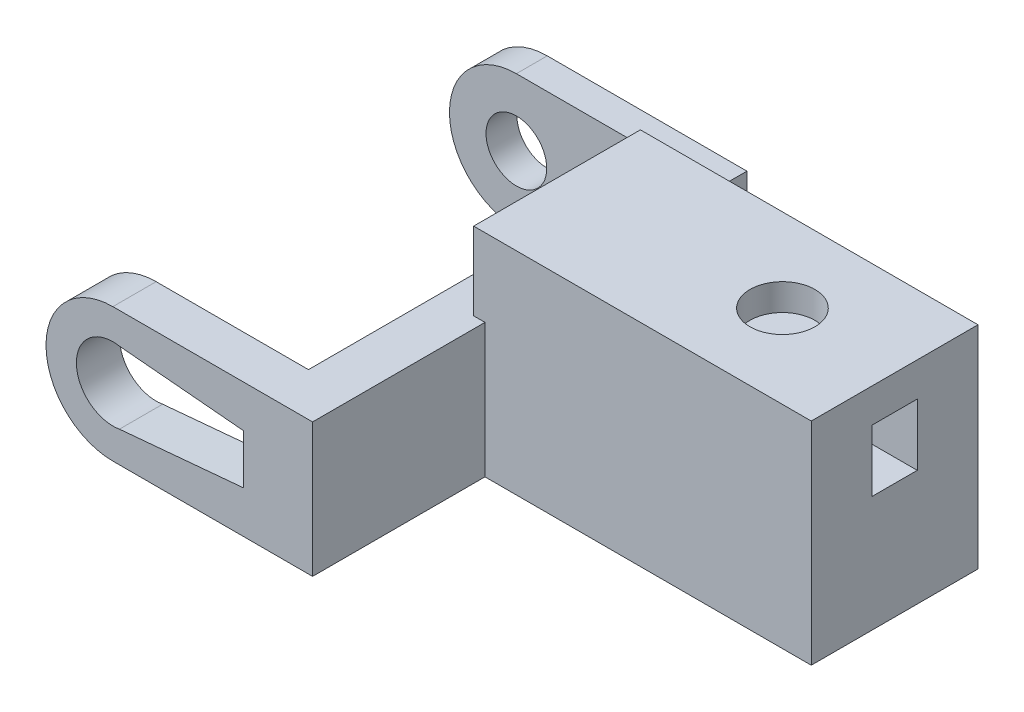
from build123d import *

# Parameters (mm, degrees)
BOSS_EXTRUDE1_START = -60.725
SKETCH1_W           = 32.8
SKETCH1_H           = 16.2
BOSS_EXTRUDE1_DEPTH = 10.275
BOSS_EXTRUDE2_START = -42.3
SKETCH2_W           = 42.2
SKETCH2_H           = 13
BOSS_EXTRUDE2_DEPTH = 2.3
BOSS_EXTRUDE3_START = 22.75
SKETCH3_R           = 6.5
BOSS_EXTRUDE3_DEPTH = 2.1
BOSS_EXTRUDE4_START = 22.75
SKETCH4_W           = 18.3
SKETCH4_H           = 13
BOSS_EXTRUDE4_DEPTH = 2.1
CUT_EXTRUDE1_START  = 22.75
SKETCH5_R           = 3.55
CUT_EXTRUDE1_DEPTH  = 2.1
CUT_EXTRUDE2_START  = 22.75
CUT_EXTRUDE2_DEPTH  = 2.1
BOSS_EXTRUDE5_START = -15.85
SKETCH7_R           = 6.5
BOSS_EXTRUDE5_DEPTH = 1.5
BOSS_EXTRUDE6_START = -15.85
SKETCH8_W           = 18.3
SKETCH8_H           = 13
BOSS_EXTRUDE6_DEPTH = 1.5
CUT_EXTRUDE3_START  = -15.85
SKETCH9_R           = 2.95
CUT_EXTRUDE3_DEPTH  = 1.5
CUT_EXTRUDE4_START  = -62.375
SKETCH10_W          = 23.2
SKETCH10_H          = 13
CUT_EXTRUDE4_DEPTH  = 8.625
CUT_EXTRUDE5_START  = -68
SKETCH11_R          = 1
CUT_EXTRUDE5_DEPTH  = 3
CUT_EXTRUDE6_START  = -68
SKETCH12_R          = 1
CUT_EXTRUDE6_DEPTH  = 3
CUT_EXTRUDE7_START  = -51.75
SKETCH13_R          = 3.15
CUT_EXTRUDE7_DEPTH  = 1.3
CUT_EXTRUDE8_START  = -10.7
SKETCH14_W          = 4.4
SKETCH14_H          = 6
CUT_EXTRUDE8_DEPTH  = 2.4


with BuildPart() as part:
    # Sketch1 → Boss-Extrude1 (new, symmetric)
    with BuildSketch(Plane(origin=(0, 0, 0), x_dir=(1, 0, 0), z_dir=(0, 1, 0)).offset(BOSS_EXTRUDE1_START)):
        with Locations((-24.7, 0)):
            Rectangle(SKETCH1_W, SKETCH1_H)
    extrude(amount=BOSS_EXTRUDE1_DEPTH, both=True)

    # Sketch2 → Boss-Extrude2 (add, symmetric)
    with BuildSketch(Plane(origin=(0, 0, 0), x_dir=(0, 0, -1), z_dir=(1, 0, 0)).offset(BOSS_EXTRUDE2_START)):
        with Locations((-3.75, -64.5)):
            Rectangle(SKETCH2_W, SKETCH2_H)
    extrude(amount=BOSS_EXTRUDE2_DEPTH, both=True)



with BuildPart() as body_2:
    # Sketch3 → Boss-Extrude3 (new, symmetric)
    with BuildSketch(Plane.XY.offset(BOSS_EXTRUDE3_START)):
        with Locations((-59.4, -64.5)):
            Circle(SKETCH3_R)
    extrude(amount=BOSS_EXTRUDE3_DEPTH, both=True)


with BuildPart() as part_1:
    add(part.part)

    add(body_2.part)  # Boss-Extrude4 merges body 2
    # Sketch4 → Boss-Extrude4 (add, symmetric)
    with BuildSketch(Plane.XY.offset(BOSS_EXTRUDE4_START)):
        with Locations((-50.25, -64.5)):
            Rectangle(SKETCH4_W, SKETCH4_H)
    extrude(amount=BOSS_EXTRUDE4_DEPTH, both=True)

    # Sketch5 → Cut-Extrude1 (cut, symmetric)
    with BuildSketch(Plane.XY.offset(CUT_EXTRUDE1_START)):
        with Locations((-59.4, -64.5)):
            Circle(SKETCH5_R)
    extrude(amount=CUT_EXTRUDE1_DEPTH, both=True, mode=Mode.SUBTRACT)

    # Sketch6 → Cut-Extrude2 (cut, symmetric)
    with BuildSketch(Plane.XY.offset(CUT_EXTRUDE2_START)):
        Polygon((-59.4, -60.95), (-46.7, -62.096718595), (-46.7, -66.903281405), (-59.4, -68.05), align=None)
    extrude(amount=CUT_EXTRUDE2_DEPTH, both=True, mode=Mode.SUBTRACT)



with BuildPart() as body_2_2:
    # Sketch7 → Boss-Extrude5 (new, symmetric)
    with BuildSketch(Plane.XY.offset(BOSS_EXTRUDE5_START)):
        with Locations((-59.4, -64.5)):
            Circle(SKETCH7_R)
    extrude(amount=BOSS_EXTRUDE5_DEPTH, both=True)


with BuildPart() as part_2:
    add(part_1.part)

    add(body_2_2.part)  # Boss-Extrude6 merges body 2 2
    # Sketch8 → Boss-Extrude6 (add, symmetric)
    with BuildSketch(Plane.XY.offset(BOSS_EXTRUDE6_START)):
        with Locations((-50.25, -64.5)):
            Rectangle(SKETCH8_W, SKETCH8_H)
    extrude(amount=BOSS_EXTRUDE6_DEPTH, both=True)

    # Sketch9 → Cut-Extrude3 (cut, symmetric)
    with BuildSketch(Plane.XY.offset(CUT_EXTRUDE3_START)):
        with Locations((-59.4, -64.5)):
            Circle(SKETCH9_R)
    extrude(amount=CUT_EXTRUDE3_DEPTH, both=True, mode=Mode.SUBTRACT)

    # Sketch10 → Cut-Extrude4 (cut, symmetric)
    with BuildSketch(Plane(origin=(0, 0, 0), x_dir=(1, 0, 0), z_dir=(0, 1, 0)).offset(CUT_EXTRUDE4_START)):
        with Locations((-24.7, 0)):
            Rectangle(SKETCH10_W, SKETCH10_H)
    extrude(amount=CUT_EXTRUDE4_DEPTH, both=True, mode=Mode.SUBTRACT)

    # Sketch11 → Cut-Extrude5 (cut, symmetric)
    with BuildSketch(Plane(origin=(0, 0, 0), x_dir=(1, 0, 0), z_dir=(0, 1, 0)).offset(CUT_EXTRUDE5_START)):
        with Locations(Location((-38.45, 0, 0), (0, 0, 270))):
            Circle(SKETCH11_R)
    extrude(amount=CUT_EXTRUDE5_DEPTH, both=True, mode=Mode.SUBTRACT)

    # Sketch12 → Cut-Extrude6 (cut, symmetric)
    with BuildSketch(Plane(origin=(0, 0, 0), x_dir=(1, 0, 0), z_dir=(0, 1, 0)).offset(CUT_EXTRUDE6_START)):
        with Locations(Location((-10.95, 0, 0), (0, 0, 270))):
            Circle(SKETCH12_R)
    extrude(amount=CUT_EXTRUDE6_DEPTH, both=True, mode=Mode.SUBTRACT)

    # Sketch13 → Cut-Extrude7 (cut, symmetric)
    with BuildSketch(Plane(origin=(0, 0, 0), x_dir=(1, 0, 0), z_dir=(0, 1, 0)).offset(CUT_EXTRUDE7_START)):
        with Locations(Location((-19.2, 0, 0), (0, 0, 270))):
            Circle(SKETCH13_R)
    extrude(amount=CUT_EXTRUDE7_DEPTH, both=True, mode=Mode.SUBTRACT)

    # Sketch14 → Cut-Extrude8 (cut, symmetric)
    with BuildSketch(Plane(origin=(0, 0, 0), x_dir=(0, 0, -1), z_dir=(1, 0, 0)).offset(CUT_EXTRUDE8_START)):
        with Locations((0, -56.75)):
            Rectangle(SKETCH14_W, SKETCH14_H)
    extrude(amount=CUT_EXTRUDE8_DEPTH, both=True, mode=Mode.SUBTRACT)


solid = part_2.part
